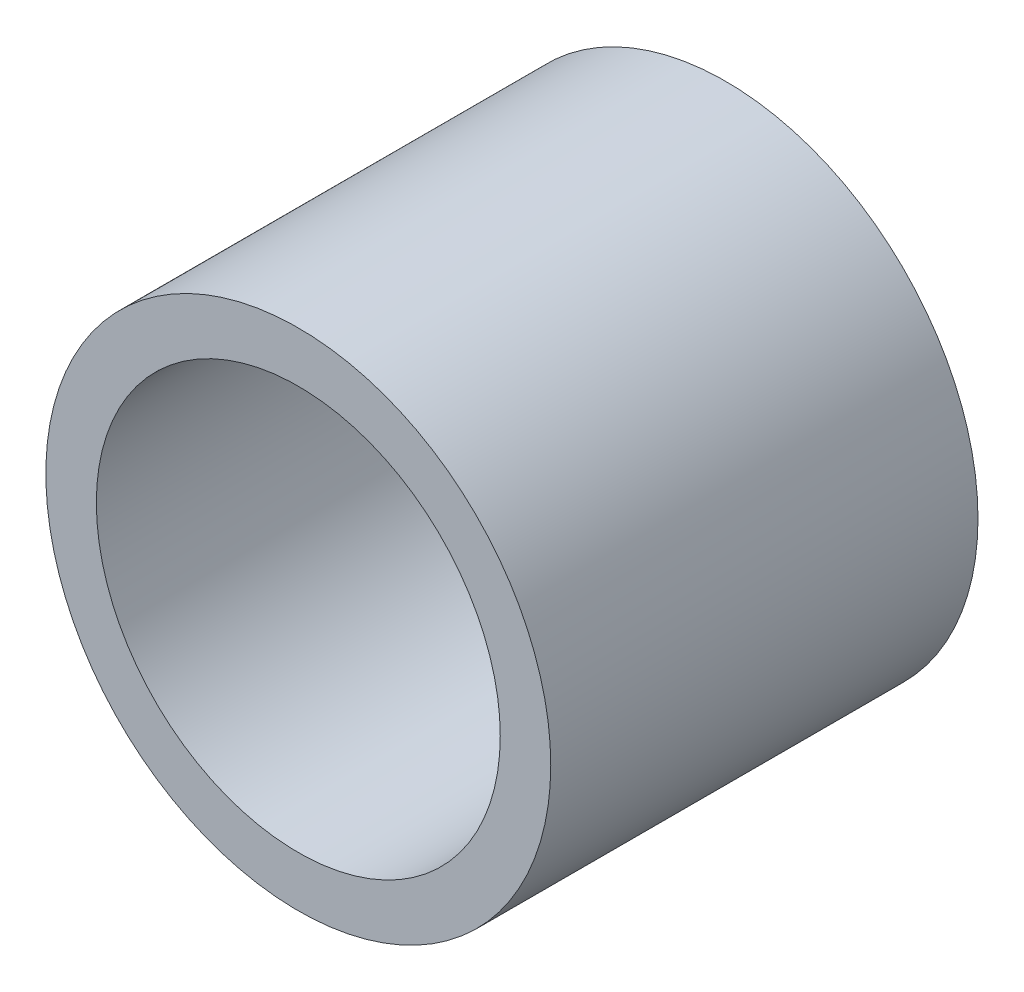
from build123d import *

# Parameters (mm, degrees)
CROQUIS1_R              = 3.25
CROQUIS1_R_2            = 2.6
SALIENTE_EXTRUIR1_DEPTH = 5.5


with BuildPart() as part:
    # Croquis1 → Saliente-Extruir1 (new body)
    with BuildSketch(Plane.XY):
        Circle(CROQUIS1_R)
        Circle(CROQUIS1_R_2, mode=Mode.SUBTRACT)
    extrude(amount=-SALIENTE_EXTRUIR1_DEPTH)


solid = part.part
